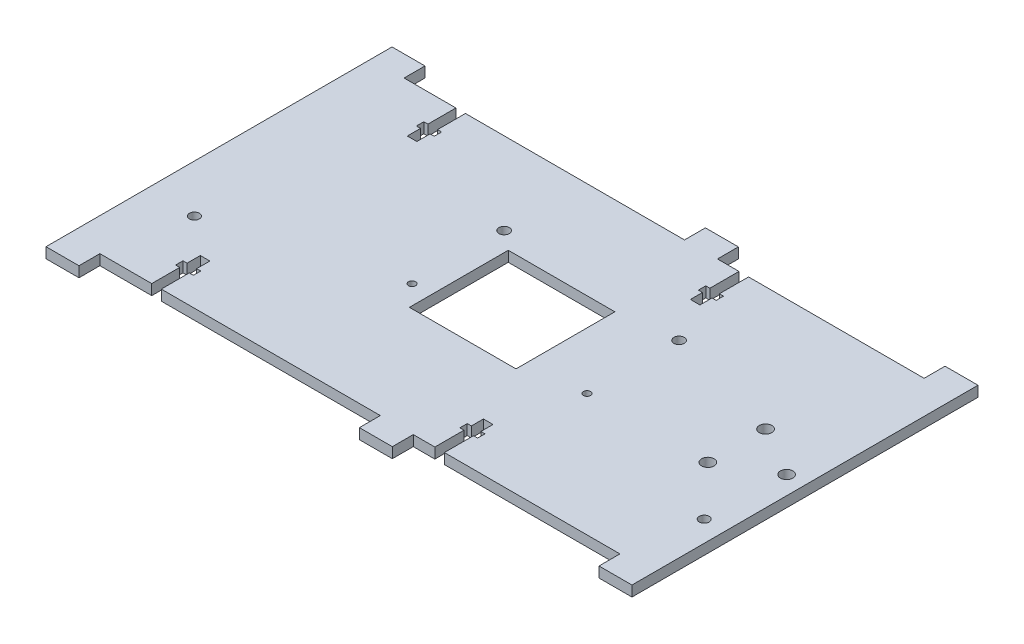
from build123d import *

# Parameters (mm, degrees)
SKETCH1_R      = 1.9
SKETCH1_R_2    = 1.58353158
SKETCH1_R_3    = 1.50705101
SKETCH1_R_4    = 1.0795
SKETCH1_W      = 32.345315457
SKETCH1_H      = 30
EXTRUDE1_DEPTH = 3.175


with BuildPart() as part:
    # Sketch1 → Extrude1 (new body)
    with BuildSketch(Plane(origin=(0, 0, 0), x_dir=(1, 0, 0), z_dir=(0, 1, 0))):
        Polygon((-67.158636898, 70.484310302), (-67.158636898, 74.492800404), (-68.408636898, 74.492800404), (-68.408636898, 76.742800404), (-67.158636898, 76.742800404), (-67.158636898, 85.234310302), (-82.88813161, 85.234310302), (-82.88813161, 91.584310302), (-92.88813161, 91.584310302), (-92.88813161, -13.415689698), (-82.88813161, -13.415689698), (-82.88813161, -7.065689698), (-67.158636898, -7.065689698), (-67.158636898, 1.425820201), (-68.408636898, 1.425820201), (-68.408636898, 3.675820201), (-67.158636898, 3.675820201), (-67.158636898, 7.684310302), (-64.258636898, 7.684310302), (-64.258636898, 3.675820201), (-63.008636898, 3.675820201), (-63.008636898, 1.425820201), (-64.258636898, 1.425820201), (-64.258636898, -7.065689698), (2.20186839, -7.065689698), (2.20186839, -13.415689698), (12.20186839, -13.415689698), (12.20186839, -7.065689698), (18.744143558, -7.065689698), (18.744143558, 1.771032224), (17.494143558, 1.771032224), (17.494143558, 4.021032224), (18.744143558, 4.021032224), (18.744143558, 7.684310302), (21.644143558, 7.684310302), (21.644143558, 4.021032224), (22.894143558, 4.021032224), (22.894143558, 1.771032224), (21.644143558, 1.771032224), (21.644143558, -7.065689698), (74.914143558, -7.065689698), (74.914143558, -13.415689698), (84.914143558, -13.415689698), (84.914143558, 91.584310302), (74.914143558, 91.584310302), (74.914143558, 85.234310302), (21.644143558, 85.234310302), (21.644143558, 76.397588381), (22.894143558, 76.397588381), (22.894143558, 74.147588381), (21.644143558, 74.147588381), (21.644143558, 70.484310302), (18.744143558, 70.484310302), (18.744143558, 74.147588381), (17.494143558, 74.147588381), (17.494143558, 76.397588381), (18.744143558, 76.397588381), (18.744143558, 85.234310302), (12.20186839, 85.234310302), (12.20186839, 91.584310302), (2.20186839, 91.584310302), (2.20186839, 85.234310302), (-64.258636898, 85.234310302), (-64.258636898, 76.742800404), (-63.008636898, 76.742800404), (-63.008636898, 74.492800404), (-64.258636898, 74.492800404), (-64.258636898, 70.484310302), align=None)
        with Locations(Location((79.354143558, 39.084310302, 0), (0, 0, 270))):
            Circle(SKETCH1_R, mode=Mode.SUBTRACT)
        with Locations(Location((64.198698991, 30.334310302, 0), (0, 0, 270))):
            Circle(SKETCH1_R, mode=Mode.SUBTRACT)
        with Locations(Location((64.198698991, 47.834310302, 0), (0, 0, 270))):
            Circle(SKETCH1_R, mode=Mode.SUBTRACT)
        with Locations(Location((27.777428137, 58.025608002, 0), (0, 0, 270))):
            Circle(SKETCH1_R_2, mode=Mode.SUBTRACT)
        with Locations(Location((78.577377337, 14.845608002, 0), (0, 0, 270))):
            Circle(SKETCH1_R_3, mode=Mode.SUBTRACT)
        with Locations(Location((27.777428137, 30.085608002, 0), (0, 0, 270))):
            Circle(SKETCH1_R_4, mode=Mode.SUBTRACT)
        with Locations(Location((-78.42302428, 17.147481819, 0), (0, 0, 270))):
            Circle(SKETCH1_R_3, mode=Mode.SUBTRACT)
        with Locations(Location((-27.62307508, 32.387481819, 0), (0, 0, 270))):
            Circle(SKETCH1_R_4, mode=Mode.SUBTRACT)
        with Locations(Location((-27.62307508, 60.327481819, 0), (0, 0, 270))):
            Circle(SKETCH1_R_2, mode=Mode.SUBTRACT)
        with Locations((-5.646064502, 40.784310302)):
            Rectangle(SKETCH1_W, SKETCH1_H, mode=Mode.SUBTRACT)
    extrude(amount=EXTRUDE1_DEPTH)


solid = part.part
